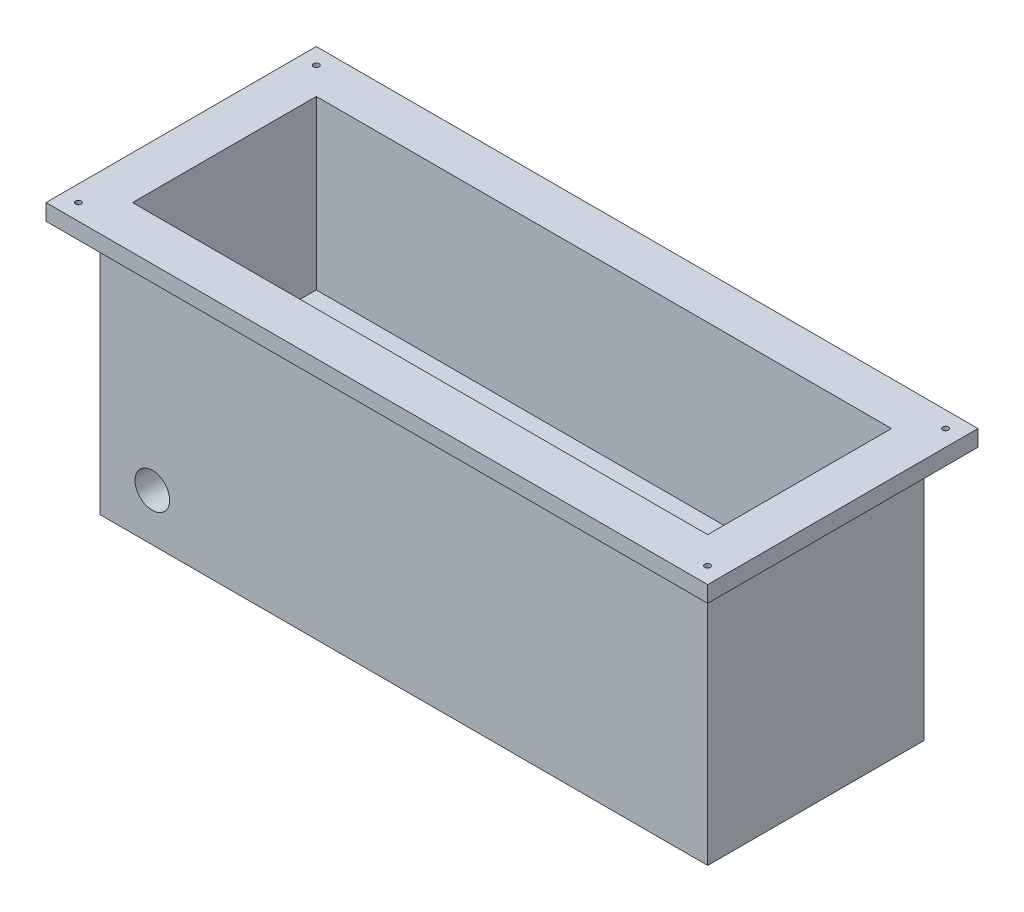
from build123d import *

# Parameters (mm, degrees)
SKETCH1_W                                   = 142.748
SKETCH1_H                                   = 50.8
BOSS_EXTRUDE1_DEPTH                         = 63.5
SHELL1_T                                    = -3.81
SKETCH2_W                                   = 155.448
SKETCH2_H                                   = 3.81
BOSS_EXTRUDE2_DEPTH                         = 6.35
SKETCH3_W                                   = 155.448
SKETCH3_H                                   = 3.81
BOSS_EXTRUDE3_DEPTH                         = 6.35
SKETCH4_W                                   = 50.8
SKETCH4_H                                   = 3.81
BOSS_EXTRUDE4_DEPTH                         = 6.35
SKETCH5_W                                   = 50.8
SKETCH5_H                                   = 3.81
BOSS_EXTRUDE5_DEPTH                         = 6.35
CBORE_FOR_00_BINDING_HEAD_MACHINE_S_2_COUNT = 2
CBORE_FOR_00_BINDING_HEAD_MACHINE_S_2_PITCH = 147.800013628
CBORE_FOR_00_BINDING_HEAD_MACHINE_S_3_COUNT = 2
CBORE_FOR_00_BINDING_HEAD_MACHINE_S_3_PITCH = 158.036995618
CBORE_FOR_00_BINDING_HEAD_MACHINE_S_4_COUNT = 2
CBORE_FOR_00_BINDING_HEAD_MACHINE_S_4_PITCH = 55.88
SKETCH13_W                                  = 135.128
SKETCH13_H                                  = 6.604
BOSS_EXTRUDE6_DEPTH                         = 20.32
SKETCH14_R                                  = 4.072823047
CUT_EXTRUDE1_DEPTH                          = 13.97


with BuildPart() as part:
    # Sketch1 → Boss-Extrude1 (new body)
    with BuildSketch(Plane(origin=(0, 0, 0), x_dir=(1, 0, 0), z_dir=(0, 1, 0))):
        with Locations((71.374, 25.4)):
            Rectangle(SKETCH1_W, SKETCH1_H)
    extrude(amount=BOSS_EXTRUDE1_DEPTH)

    # Shell1
    shell1_openings = [part.faces().sort_by_distance(p)[0] for p in [
        (71.374, 63.5, -25.4),
    ]]
    offset(amount=SHELL1_T, openings=shell1_openings, kind=Kind.INTERSECTION)

    # Sketch2 → Boss-Extrude2 (add)
    with BuildSketch(Plane.XY):
        with Locations((71.374, 61.595)):
            Rectangle(SKETCH2_W, SKETCH2_H)
    extrude(amount=BOSS_EXTRUDE2_DEPTH)

    # Sketch3 → Boss-Extrude3 (add)
    with BuildSketch(Plane(origin=(0, 0, -50.8), x_dir=(-1, 0, 0), z_dir=(0, 0, -1))):
        with Locations((-71.374, 61.595)):
            Rectangle(SKETCH3_W, SKETCH3_H)
    extrude(amount=BOSS_EXTRUDE3_DEPTH)

    # Sketch4 → Boss-Extrude4 (add)
    with BuildSketch(Plane.ZY):
        with Locations((-25.4, 61.595)):
            Rectangle(SKETCH4_W, SKETCH4_H)
    extrude(amount=BOSS_EXTRUDE4_DEPTH)

    # Sketch5 → Boss-Extrude5 (add)
    with BuildSketch(Plane(origin=(142.748, 0, 0), x_dir=(0, 0, -1), z_dir=(1, 0, 0))):
        with Locations((25.4, 61.595)):
            Rectangle(SKETCH5_W, SKETCH5_H)
    extrude(amount=BOSS_EXTRUDE5_DEPTH)

    # Sketch11 → CBORE for #00 Binding Head Machine Screw3 (revolve, cut)
    with BuildSketch(Plane(origin=(-2.54, 59.69, 2.54), x_dir=(0, 0, -1), z_dir=(1, 0, 0))):
        Polygon((0, 0), (0, 3.81), (0.6604, 3.81), (0.6604, 0.7112), (1.5875, 0.7112), (1.5875, 0.532828266), (2.2225, 0), align=None)
    cbore_for_00_binding_head_machine_screw = revolve(axis=Axis((-2.54, 53.34, 2.54), (0, 1, 0)), mode=Mode.SUBTRACT)

    # CBORE for _00 Binding Head Machine S 2: CBORE for #00 Binding Head Machine Screw3 ×2
    with Locations(*[(i * CBORE_FOR_00_BINDING_HEAD_MACHINE_S_2_PITCH, 0, 0) for i in range(1, CBORE_FOR_00_BINDING_HEAD_MACHINE_S_2_COUNT)]):
        add(cbore_for_00_binding_head_machine_screw, mode=Mode.SUBTRACT)

    # CBORE for _00 Binding Head Machine S 3: CBORE for #00 Binding Head Machine Screw3 ×2
    with Locations(*[Vector(0.9354012294514634, 0, -0.35358809360708243) * (i * CBORE_FOR_00_BINDING_HEAD_MACHINE_S_3_PITCH) for i in range(1, CBORE_FOR_00_BINDING_HEAD_MACHINE_S_3_COUNT)]):
        add(cbore_for_00_binding_head_machine_screw, mode=Mode.SUBTRACT)

    # CBORE for _00 Binding Head Machine S 4: CBORE for #00 Binding Head Machine Screw3 ×2
    with Locations(*[(0, 0, -i * CBORE_FOR_00_BINDING_HEAD_MACHINE_S_4_PITCH) for i in range(1, CBORE_FOR_00_BINDING_HEAD_MACHINE_S_4_COUNT)]):
        add(cbore_for_00_binding_head_machine_screw, mode=Mode.SUBTRACT)

    # Sketch13 → Boss-Extrude6 (add)
    with BuildSketch(Plane(origin=(0, 3.81, 0), x_dir=(1, 0, 0), z_dir=(0, 1, 0))):
        with Locations((71.374, 43.688)):
            Rectangle(SKETCH13_W, SKETCH13_H)
        with Locations((71.374, 7.112)):
            Rectangle(SKETCH13_W, SKETCH13_H)
    extrude(amount=BOSS_EXTRUDE6_DEPTH)

    # Sketch14 → Cut-Extrude1 (cut)
    with BuildSketch(Plane.XY):
        with Locations((12.280475356, 11.107728565)):
            Circle(SKETCH14_R)
    extrude(amount=-CUT_EXTRUDE1_DEPTH, mode=Mode.SUBTRACT)


solid = part.part
